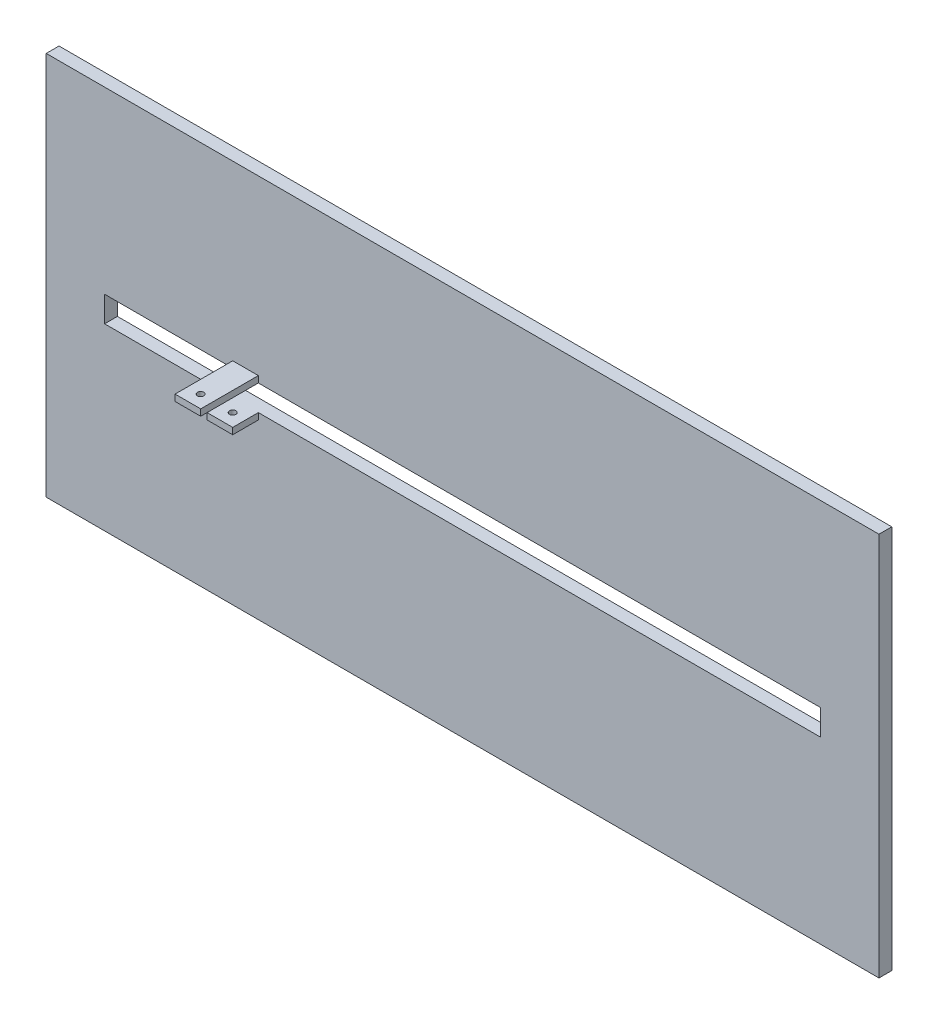
from build123d import *

# Parameters (mm, degrees)
SKETCH1_W           = 1300
SKETCH1_H           = 600
SKETCH1_W_2         = 1117.676372874
SKETCH1_H_2         = 40
BOSS_EXTRUDE1_DEPTH = 20
SKETCH2_W           = 40
SKETCH2_H           = 10
BOSS_EXTRUDE2_DEPTH = 40
SKETCH3_R           = 5
CUT_EXTRUDE1_DEPTH  = 10
SKETCH4_W           = 40
SKETCH4_H           = 10
BOSS_EXTRUDE3_DEPTH = 50
SKETCH5_R           = 5
CUT_EXTRUDE2_DEPTH  = 10


with BuildPart() as part:
    # Sketch1 → Boss-Extrude1 (new body)
    with BuildSketch(Plane.XY):
        Rectangle(SKETCH1_W, SKETCH1_H)
        Rectangle(SKETCH1_W_2, SKETCH1_H_2, mode=Mode.SUBTRACT)
    extrude(amount=BOSS_EXTRUDE1_DEPTH)

    # Sketch2 → Boss-Extrude2 (add)
    with BuildSketch(Plane.XY.offset(20)):
        with Locations((-338.838186437, 25)):
            Rectangle(SKETCH2_W, SKETCH2_H)
        with Locations((-338.838186437, -25)):
            Rectangle(SKETCH2_W, SKETCH2_H)
    extrude(amount=BOSS_EXTRUDE2_DEPTH)

    # Sketch3 → Cut-Extrude1 (cut)
    with BuildSketch(Plane.XZ.offset(30)):
        with Locations((-338.838186437, 40)):
            Circle(SKETCH3_R)
    extrude(amount=-CUT_EXTRUDE1_DEPTH, mode=Mode.SUBTRACT)

    # Sketch4 → Boss-Extrude3 (add)
    with BuildSketch(Plane.XY.offset(60)):
        with Locations((-338.838186437, 25)):
            Rectangle(SKETCH4_W, SKETCH4_H)
    extrude(amount=BOSS_EXTRUDE3_DEPTH)

    # Sketch5 → Cut-Extrude2 (cut)
    with BuildSketch(Plane.XZ.offset(-20)):
        with Locations(Location((-338.838186437, 90, 0), (0, 0, 270))):
            Circle(SKETCH5_R)
    extrude(amount=-CUT_EXTRUDE2_DEPTH, mode=Mode.SUBTRACT)


solid = part.part
